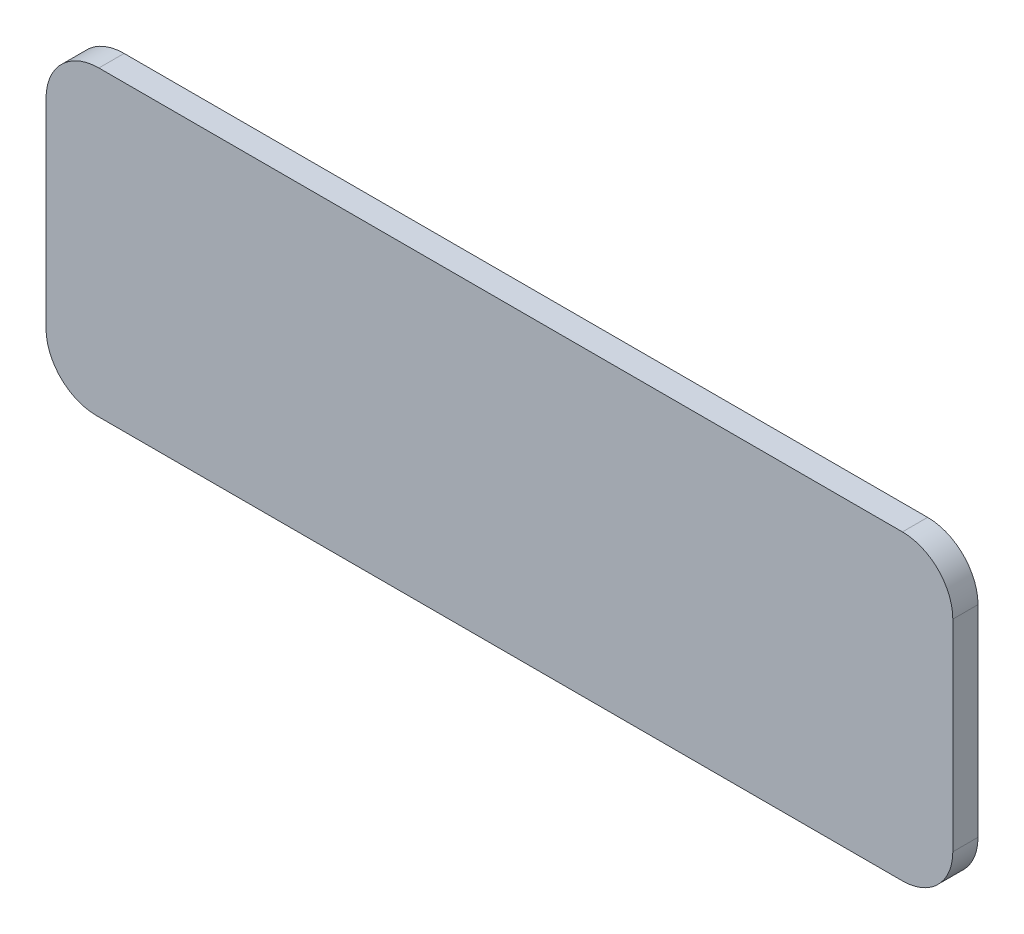
from build123d import *

# Parameters (mm, degrees)
EXTRUDE_1_DEPTH = 1


with BuildPart() as part:
    # 草图1 → 凸台-拉伸1 (new body)
    with BuildSketch(Plane.XY):
        with BuildLine():
            Line((2, 0), (34, 0))
            ThreePointArc((34, 0), (35.414213562, 0.585786438), (36, 2))
            Line((36, 2), (36, 10))
            ThreePointArc((36, 10), (35.414213562, 11.414213562), (34, 12))
            Line((34, 12), (2.1, 12))
            ThreePointArc((2.1, 12), (0.61507576, 11.38492424), (0, 9.9))
            Line((0, 9.9), (0, 2))
            ThreePointArc((0, 2), (0.585786438, 0.585786438), (2, 0))
        make_face()
    extrude(amount=EXTRUDE_1_DEPTH)


solid = part.part
